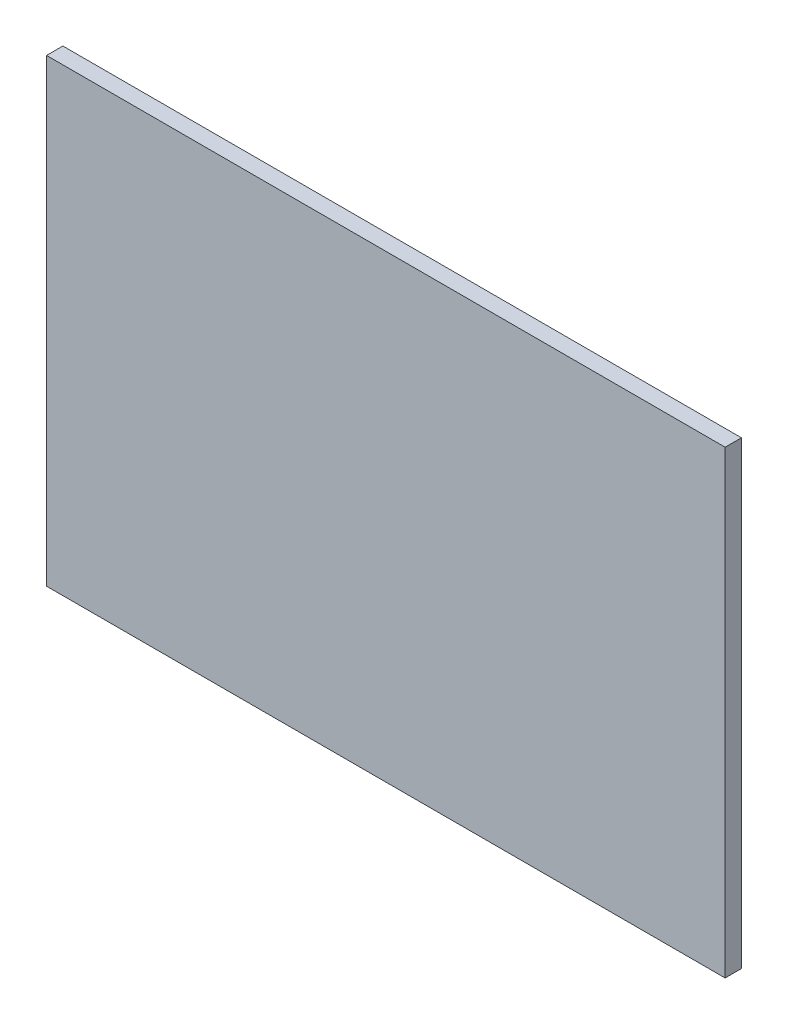
from build123d import *

# Parameters (mm, degrees)
SKETCH_1_W      = 124
SKETCH_1_H      = 84
EXTRUDE_1_DEPTH = 2.98


with BuildPart() as part:
    # 草圖1 → 填料-伸長1 (new body)
    with BuildSketch(Plane.XY):
        with Locations((62, -42)):
            Rectangle(SKETCH_1_W, SKETCH_1_H)
    extrude(amount=EXTRUDE_1_DEPTH)


solid = part.part
